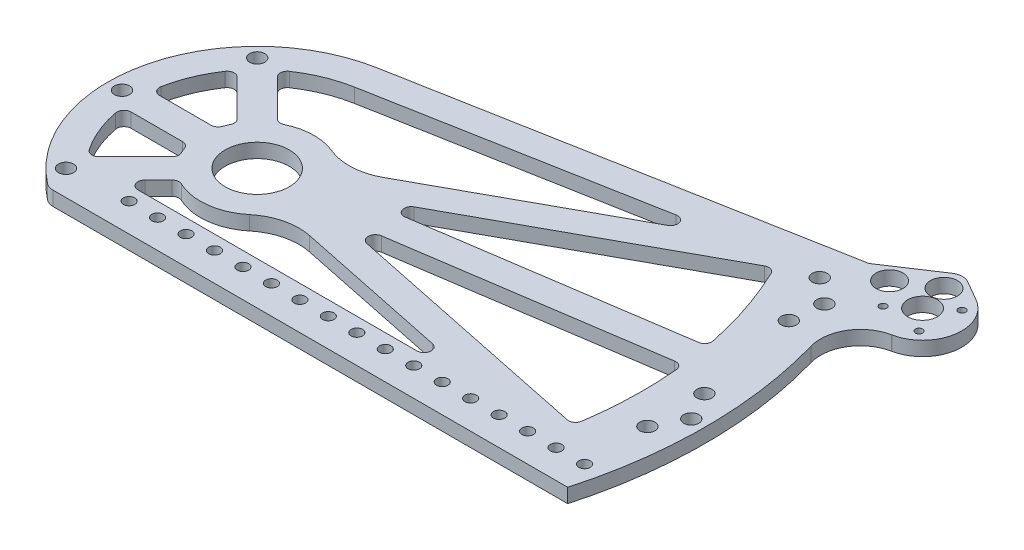
from build123d import *

# Parameters (mm, degrees)
SKETCH1_R           = 3.3782
SKETCH1_R_2         = 14.28115
SKETCH1_R_3         = 2.5527
SKETCH1_R_4         = 9.5885
SKETCH1_R_5         = 19.177
SKETCH1_R_6         = 4.1275
BOSS_EXTRUDE1_DEPTH = 6.35
SKETCH2_R           = 19.177
SKETCH2_R_2         = 2.5527
SKETCH2_R_3         = 4.1275
SKETCH2_R_4         = 9.5885
BOSS_EXTRUDE2_DEPTH = 6.35
CUT_EXTRUDE1_DEPTH  = 337.819467594
BOSS_EXTRUDE3_DEPTH = 6.35
SKETCH9_R           = 6.00075
SKETCH9_R_2         = 1.6
SKETCH9_R_3         = 6.6
BOSS_EXTRUDE4_DEPTH = 6.35
FILLET1_R           = 17.78
SKETCH10_R          = 3.3782
BOSS_EXTRUDE5_DEPTH = 6.35
CUT_EXTRUDE2_DEPTH  = 249.5818865
FILLET2_R           = 25.4
FILLET3_R           = 3.175


with BuildPart() as part:
    # Sketch1 → Boss-Extrude1 (new body)
    with BuildSketch(Plane.XZ):
        with BuildLine():
            Line((231.775, 53.975), (-37.026544532, 53.975))
            ThreePointArc((-37.026544532, 53.975), (-39.086756581, 53.631498674), (-40.924075536, 52.638157895))
            ThreePointArc((-40.924075536, 52.638157895), (-66.304119268, -7.022776738), (-28.989130435, -60.043200628))
            ThreePointArc((-28.989130435, -60.043200628), (-26.371616333, -62.385880153), (-25.4, -65.761600688))
            Line((-25.4, -65.761600688), (-25.4, -230.990796624))
            ThreePointArc((-25.4, -230.990796624), (-23.721010495, -235.292442932), (-19.571917808, -237.3193116))
            ThreePointArc((-19.571917808, -237.3193116), (161.311736549, -175.162893549), (238.125, 0))
            Line((238.125, 0), (238.125, 47.625))
            ThreePointArc((238.125, 47.625), (236.265128061, 52.115128061), (231.775, 53.975))
        make_face()
        with Locations(Location((-60.325, 0, 0), (0, 0, 90))):
            Circle(SKETCH1_R, mode=Mode.SUBTRACT)
        with Locations(Location((-42.656216575, 42.656216575, 0), (0, 0, 90))):
            Circle(SKETCH1_R, mode=Mode.SUBTRACT)
        with Locations(Location((-42.656216575, -42.656216575, 0), (0, 0, 90))):
            Circle(SKETCH1_R, mode=Mode.SUBTRACT)
        with Locations(Location((0, -155.575, 0), (0, 0, 90))):
            Circle(SKETCH1_R, mode=Mode.SUBTRACT)
        with Locations(Location((0, -168.275, 0), (0, 0, 90))):
            Circle(SKETCH1_R, mode=Mode.SUBTRACT)
        with Locations(Location((0, -180.975, 0), (0, 0, 90))):
            Circle(SKETCH1_R, mode=Mode.SUBTRACT)
        with Locations(Location((0, -193.675, 0), (0, 0, 90))):
            Circle(SKETCH1_R, mode=Mode.SUBTRACT)
        with Locations(Location((0, -206.375, 0), (0, 0, 90))):
            Circle(SKETCH1_R, mode=Mode.SUBTRACT)
        with Locations(Location((0, -219.075, 0), (0, 0, 90))):
            Circle(SKETCH1_R, mode=Mode.SUBTRACT)
        with Locations(Location((59.53597499, -143.73255827, 0), (0, 0, 90))):
            Circle(SKETCH1_R, mode=Mode.SUBTRACT)
        with Locations(Location((64.396054581, -155.465828333, 0), (0, 0, 90))):
            Circle(SKETCH1_R, mode=Mode.SUBTRACT)
        with Locations(Location((69.256134172, -167.199098396, 0), (0, 0, 90))):
            Circle(SKETCH1_R, mode=Mode.SUBTRACT)
        with Locations(Location((74.116213763, -178.932368459, 0), (0, 0, 90))):
            Circle(SKETCH1_R, mode=Mode.SUBTRACT)
        with Locations(Location((78.976293354, -190.665638522, 0), (0, 0, 90))):
            Circle(SKETCH1_R, mode=Mode.SUBTRACT)
        with Locations(Location((83.836372945, -202.398908585, 0), (0, 0, 90))):
            Circle(SKETCH1_R, mode=Mode.SUBTRACT)
        with Locations(Location((110.008137483, -110.008137483, 0), (0, 0, 90))):
            Circle(SKETCH1_R, mode=Mode.SUBTRACT)
        with Locations(Location((118.988393604, -118.988393604, 0), (0, 0, 90))):
            Circle(SKETCH1_R, mode=Mode.SUBTRACT)
        with Locations(Location((127.968649725, -127.968649725, 0), (0, 0, 90))):
            Circle(SKETCH1_R, mode=Mode.SUBTRACT)
        with Locations(Location((136.948905846, -136.948905846, 0), (0, 0, 90))):
            Circle(SKETCH1_R, mode=Mode.SUBTRACT)
        with Locations(Location((145.929161967, -145.929161967, 0), (0, 0, 90))):
            Circle(SKETCH1_R, mode=Mode.SUBTRACT)
        with Locations(Location((154.909418088, -154.909418088, 0), (0, 0, 90))):
            Circle(SKETCH1_R, mode=Mode.SUBTRACT)
        with Locations(Location((143.73255827, -59.53597499, 0), (0, 0, 90))):
            Circle(SKETCH1_R, mode=Mode.SUBTRACT)
        with Locations(Location((155.465828333, -64.396054581, 0), (0, 0, 90))):
            Circle(SKETCH1_R, mode=Mode.SUBTRACT)
        with Locations(Location((167.199098396, -69.256134172, 0), (0, 0, 90))):
            Circle(SKETCH1_R, mode=Mode.SUBTRACT)
        with Locations(Location((178.932368459, -74.116213763, 0), (0, 0, 90))):
            Circle(SKETCH1_R, mode=Mode.SUBTRACT)
        with Locations(Location((190.665638522, -78.976293354, 0), (0, 0, 90))):
            Circle(SKETCH1_R, mode=Mode.SUBTRACT)
        with Locations(Location((202.398908585, -83.836372945, 0), (0, 0, 90))):
            Circle(SKETCH1_R, mode=Mode.SUBTRACT)
        with Locations(Location((155.575, 0, 0), (0, 0, 90))):
            Circle(SKETCH1_R, mode=Mode.SUBTRACT)
        with Locations(Location((168.275, 0, 0), (0, 0, 90))):
            Circle(SKETCH1_R, mode=Mode.SUBTRACT)
        with Locations(Location((180.975, 0, 0), (0, 0, 90))):
            Circle(SKETCH1_R, mode=Mode.SUBTRACT)
        with Locations(Location((193.675, 0, 0), (0, 0, 90))):
            Circle(SKETCH1_R, mode=Mode.SUBTRACT)
        with Locations(Location((206.375, 0, 0), (0, 0, 90))):
            Circle(SKETCH1_R, mode=Mode.SUBTRACT)
        with Locations(Location((219.075, 0, 0), (0, 0, 90))):
            Circle(SKETCH1_R, mode=Mode.SUBTRACT)
        with Locations(Location((0, 0, 0), (0, 0, 90))):
            Circle(SKETCH1_R_2, mode=Mode.SUBTRACT)
        with Locations(Location((148.683592319, 12.7, 0), (0, 0, 90))):
            Circle(SKETCH1_R, mode=Mode.SUBTRACT)
        with Locations(Location((141.086323741, -159.046835983, 0), (0, 0, 90))):
            Circle(SKETCH1_R, mode=Mode.SUBTRACT)
        with Locations(Location((150.036456986, -132.075944743, 0), (0, 0, 90))):
            Circle(SKETCH1_R, mode=Mode.SUBTRACT)
        with Locations(Location((150.066579862, -168.027092104, 0), (0, 0, 90))):
            Circle(SKETCH1_R, mode=Mode.SUBTRACT)
        with Locations(Location((159.016713107, -141.056200864, 0), (0, 0, 90))):
            Circle(SKETCH1_R, mode=Mode.SUBTRACT)
        with Locations(Location((-12.7, -186.8261925, 0), (0, 0, 90))):
            Circle(SKETCH1_R, mode=Mode.SUBTRACT)
        with Locations(Location((12.7, -174.083592319, 0), (0, 0, 90))):
            Circle(SKETCH1_R, mode=Mode.SUBTRACT)
        with Locations(Location((-12.7, -199.5261925, 0), (0, 0, 90))):
            Circle(SKETCH1_R, mode=Mode.SUBTRACT)
        with Locations(Location((12.7, -186.783592319, 0), (0, 0, 90))):
            Circle(SKETCH1_R, mode=Mode.SUBTRACT)
        with Locations(Location((-12.7, -212.2261925, 0), (0, 0, 90))):
            Circle(SKETCH1_R, mode=Mode.SUBTRACT)
        with Locations(Location((12.7, -199.483592319, 0), (0, 0, 90))):
            Circle(SKETCH1_R, mode=Mode.SUBTRACT)
        with Locations(Location((-12.7, -224.9261925, 0), (0, 0, 90))):
            Circle(SKETCH1_R, mode=Mode.SUBTRACT)
        with Locations(Location((12.7, -212.183592319, 0), (0, 0, 90))):
            Circle(SKETCH1_R, mode=Mode.SUBTRACT)
        with Locations(Location((69.482177721, -200.931515104, 0), (0, 0, 90))):
            Circle(SKETCH1_R, mode=Mode.SUBTRACT)
        with Locations(Location((88.072335872, -179.438728425, 0), (0, 0, 90))):
            Circle(SKETCH1_R, mode=Mode.SUBTRACT)
        with Locations(Location((74.342257312, -212.664785167, 0), (0, 0, 90))):
            Circle(SKETCH1_R, mode=Mode.SUBTRACT)
        with Locations(Location((92.932415463, -191.171998488, 0), (0, 0, 90))):
            Circle(SKETCH1_R, mode=Mode.SUBTRACT)
        with Locations(Location((50.041859357, -153.998434853, 0), (0, 0, 90))):
            Circle(SKETCH1_R, mode=Mode.SUBTRACT)
        with Locations(Location((68.632017508, -132.505648173, 0), (0, 0, 90))):
            Circle(SKETCH1_R, mode=Mode.SUBTRACT)
        with Locations(Location((54.901938948, -165.731704916, 0), (0, 0, 90))):
            Circle(SKETCH1_R, mode=Mode.SUBTRACT)
        with Locations(Location((73.492097099, -144.238918236, 0), (0, 0, 90))):
            Circle(SKETCH1_R, mode=Mode.SUBTRACT)
        with Locations(Location((59.762018539, -177.464974979, 0), (0, 0, 90))):
            Circle(SKETCH1_R, mode=Mode.SUBTRACT)
        with Locations(Location((78.35217669, -155.972188299, 0), (0, 0, 90))):
            Circle(SKETCH1_R, mode=Mode.SUBTRACT)
        with Locations(Location((64.62209813, -189.198245042, 0), (0, 0, 90))):
            Circle(SKETCH1_R, mode=Mode.SUBTRACT)
        with Locations(Location((83.212256281, -167.705458362, 0), (0, 0, 90))):
            Circle(SKETCH1_R, mode=Mode.SUBTRACT)
        with Locations(Location((123.125811499, -141.086323741, 0), (0, 0, 90))):
            Circle(SKETCH1_R, mode=Mode.SUBTRACT)
        with Locations(Location((132.075944743, -114.115432501, 0), (0, 0, 90))):
            Circle(SKETCH1_R, mode=Mode.SUBTRACT)
        with Locations(Location((132.10606762, -150.066579862, 0), (0, 0, 90))):
            Circle(SKETCH1_R, mode=Mode.SUBTRACT)
        with Locations(Location((141.056200864, -123.095688622, 0), (0, 0, 90))):
            Circle(SKETCH1_R, mode=Mode.SUBTRACT)
        with Locations(Location((200.89215767, -69.465875337, 0), (0, 0, 90))):
            Circle(SKETCH1_R, mode=Mode.SUBTRACT)
        with Locations(Location((202.944625985, -97.808797438, 0), (0, 0, 90))):
            Circle(SKETCH1_R, mode=Mode.SUBTRACT)
        with Locations(Location((189.158887607, -64.605795746, 0), (0, 0, 90))):
            Circle(SKETCH1_R, mode=Mode.SUBTRACT)
        with Locations(Location((191.211355922, -92.948717847, 0), (0, 0, 90))):
            Circle(SKETCH1_R, mode=Mode.SUBTRACT)
        with Locations(Location((105.165299257, -123.125811499, 0), (0, 0, 90))):
            Circle(SKETCH1_R, mode=Mode.SUBTRACT)
        with Locations(Location((114.115432501, -96.154920259, 0), (0, 0, 90))):
            Circle(SKETCH1_R, mode=Mode.SUBTRACT)
        with Locations(Location((114.145555378, -132.10606762, 0), (0, 0, 90))):
            Circle(SKETCH1_R, mode=Mode.SUBTRACT)
        with Locations(Location((123.095688622, -105.13517638, 0), (0, 0, 90))):
            Circle(SKETCH1_R, mode=Mode.SUBTRACT)
        with Locations(Location((153.959077418, -50.025556973, 0), (0, 0, 90))):
            Circle(SKETCH1_R, mode=Mode.SUBTRACT)
        with Locations(Location((156.011545734, -78.368479073, 0), (0, 0, 90))):
            Circle(SKETCH1_R, mode=Mode.SUBTRACT)
        with Locations(Location((142.225807355, -45.165477382, 0), (0, 0, 90))):
            Circle(SKETCH1_R, mode=Mode.SUBTRACT)
        with Locations(Location((144.278275671, -73.508399482, 0), (0, 0, 90))):
            Circle(SKETCH1_R, mode=Mode.SUBTRACT)
        with Locations(Location((177.425617544, -59.745716155, 0), (0, 0, 90))):
            Circle(SKETCH1_R, mode=Mode.SUBTRACT)
        with Locations(Location((179.478085859, -88.088638255, 0), (0, 0, 90))):
            Circle(SKETCH1_R, mode=Mode.SUBTRACT)
        with Locations(Location((165.692347481, -54.885636564, 0), (0, 0, 90))):
            Circle(SKETCH1_R, mode=Mode.SUBTRACT)
        with Locations(Location((167.744815797, -83.228558664, 0), (0, 0, 90))):
            Circle(SKETCH1_R, mode=Mode.SUBTRACT)
        with Locations(Location((-12.7, -161.4261925, 0), (0, 0, 90))):
            Circle(SKETCH1_R, mode=Mode.SUBTRACT)
        with Locations(Location((12.7, -148.683592319, 0), (0, 0, 90))):
            Circle(SKETCH1_R, mode=Mode.SUBTRACT)
        with Locations(Location((-12.7, -174.1261925, 0), (0, 0, 90))):
            Circle(SKETCH1_R, mode=Mode.SUBTRACT)
        with Locations(Location((12.7, -161.383592319, 0), (0, 0, 90))):
            Circle(SKETCH1_R, mode=Mode.SUBTRACT)
        with Locations(Location((186.8261925, -12.7, 0), (0, 0, 90))):
            Circle(SKETCH1_R, mode=Mode.SUBTRACT)
        with Locations(Location((174.083592319, 12.7, 0), (0, 0, 90))):
            Circle(SKETCH1_R, mode=Mode.SUBTRACT)
        with Locations(Location((199.5261925, -12.7, 0), (0, 0, 90))):
            Circle(SKETCH1_R, mode=Mode.SUBTRACT)
        with Locations(Location((186.783592319, 12.7, 0), (0, 0, 90))):
            Circle(SKETCH1_R, mode=Mode.SUBTRACT)
        with Locations(Location((212.2261925, -12.7, 0), (0, 0, 90))):
            Circle(SKETCH1_R, mode=Mode.SUBTRACT)
        with Locations(Location((199.483592319, 12.7, 0), (0, 0, 90))):
            Circle(SKETCH1_R, mode=Mode.SUBTRACT)
        with Locations(Location((224.9261925, -12.7, 0), (0, 0, 90))):
            Circle(SKETCH1_R, mode=Mode.SUBTRACT)
        with Locations(Location((212.183592319, 12.7, 0), (0, 0, 90))):
            Circle(SKETCH1_R, mode=Mode.SUBTRACT)
        with Locations(Location((161.4261925, -12.7, 0), (0, 0, 90))):
            Circle(SKETCH1_R, mode=Mode.SUBTRACT)
        with Locations(Location((174.1261925, -12.7, 0), (0, 0, 90))):
            Circle(SKETCH1_R, mode=Mode.SUBTRACT)
        with Locations(Location((161.383592319, 12.7, 0), (0, 0, 90))):
            Circle(SKETCH1_R, mode=Mode.SUBTRACT)
        with Locations(Location((225.425, 41.275, 0), (0, 0, 90))):
            Circle(SKETCH1_R_3, mode=Mode.SUBTRACT)
        with Locations(Location((212.725, 41.275, 0), (0, 0, 90))):
            Circle(SKETCH1_R_3, mode=Mode.SUBTRACT)
        with Locations(Location((200.025, 41.275, 0), (0, 0, 90))):
            Circle(SKETCH1_R_3, mode=Mode.SUBTRACT)
        with Locations(Location((187.325, 41.275, 0), (0, 0, 90))):
            Circle(SKETCH1_R_3, mode=Mode.SUBTRACT)
        with Locations(Location((174.625, 41.275, 0), (0, 0, 90))):
            Circle(SKETCH1_R_3, mode=Mode.SUBTRACT)
        with Locations(Location((161.925, 41.275, 0), (0, 0, 90))):
            Circle(SKETCH1_R_3, mode=Mode.SUBTRACT)
        with Locations(Location((149.225, 41.275, 0), (0, 0, 90))):
            Circle(SKETCH1_R_3, mode=Mode.SUBTRACT)
        with Locations(Location((136.525, 41.275, 0), (0, 0, 90))):
            Circle(SKETCH1_R_3, mode=Mode.SUBTRACT)
        with Locations(Location((123.825, 41.275, 0), (0, 0, 90))):
            Circle(SKETCH1_R_3, mode=Mode.SUBTRACT)
        with Locations(Location((111.125, 41.275, 0), (0, 0, 90))):
            Circle(SKETCH1_R_3, mode=Mode.SUBTRACT)
        with Locations(Location((98.425, 41.275, 0), (0, 0, 90))):
            Circle(SKETCH1_R_3, mode=Mode.SUBTRACT)
        with Locations(Location((73.025, 41.275, 0), (0, 0, 90))):
            Circle(SKETCH1_R_3, mode=Mode.SUBTRACT)
        with Locations(Location((85.725, 41.275, 0), (0, 0, 90))):
            Circle(SKETCH1_R_3, mode=Mode.SUBTRACT)
        with Locations(Location((60.325, 41.275, 0), (0, 0, 90))):
            Circle(SKETCH1_R_3, mode=Mode.SUBTRACT)
        with Locations(Location((47.625, 41.275, 0), (0, 0, 90))):
            Circle(SKETCH1_R_3, mode=Mode.SUBTRACT)
        with Locations(Location((34.925, 41.275, 0), (0, 0, 90))):
            Circle(SKETCH1_R_3, mode=Mode.SUBTRACT)
        with Locations(Location((22.225, 41.275, 0), (0, 0, 90))):
            Circle(SKETCH1_R_3, mode=Mode.SUBTRACT)
        with Locations(Location((9.525, 41.275, 0), (0, 0, 90))):
            Circle(SKETCH1_R_3, mode=Mode.SUBTRACT)
        with Locations(Location((-3.175, 41.275, 0), (0, 0, 90))):
            Circle(SKETCH1_R_3, mode=Mode.SUBTRACT)
        with Locations(Location((-15.875, 41.275, 0), (0, 0, 90))):
            Circle(SKETCH1_R_3, mode=Mode.SUBTRACT)
        with Locations(Location((-17.960512242, 17.960512242, 0), (0, 0, 90))):
            Circle(SKETCH1_R_3, mode=Mode.SUBTRACT)
        with Locations(Location((-17.960512242, -17.960512242, 0), (0, 0, 90))):
            Circle(SKETCH1_R_3, mode=Mode.SUBTRACT)
        with Locations(Location((17.960512242, -17.960512242, 0), (0, 0, 90))):
            Circle(SKETCH1_R_3, mode=Mode.SUBTRACT)
        with Locations(Location((17.960512242, 17.960512242, 0), (0, 0, 90))):
            Circle(SKETCH1_R_3, mode=Mode.SUBTRACT)
        with Locations(Location((52.114561305, -6.35, 0), (0, 0, 90))):
            Circle(SKETCH1_R_4, mode=Mode.SUBTRACT)
        with Locations(Location((70.075073547, 11.610512242, 0), (0, 0, 90))):
            Circle(SKETCH1_R_3, mode=Mode.SUBTRACT)
        with Locations(Location((-17.960512242, -34.539487758, 0), (0, 0, 90))):
            Circle(SKETCH1_R_3, mode=Mode.SUBTRACT)
        with Locations(Location((17.960512242, -70.460512242, 0), (0, 0, 90))):
            Circle(SKETCH1_R_3, mode=Mode.SUBTRACT)
        with Locations(Location((70.075073547, -24.310512242, 0), (0, 0, 90))):
            Circle(SKETCH1_R_3, mode=Mode.SUBTRACT)
        with Locations(Location((34.154049063, -24.310512242, 0), (0, 0, 90))):
            Circle(SKETCH1_R_3, mode=Mode.SUBTRACT)
        with Locations(Location((34.154049063, 11.610512242, 0), (0, 0, 90))):
            Circle(SKETCH1_R_3, mode=Mode.SUBTRACT)
        with Locations(Location((0, -52.5, 0), (0, 0, 90))):
            Circle(SKETCH1_R_5, mode=Mode.SUBTRACT)
        with Locations(Location((-17.960512242, -70.460512242, 0), (0, 0, 90))):
            Circle(SKETCH1_R_6, mode=Mode.SUBTRACT)
        with Locations(Location((17.960512242, -34.539487758, 0), (0, 0, 90))):
            Circle(SKETCH1_R_6, mode=Mode.SUBTRACT)
    extrude(amount=-BOSS_EXTRUDE1_DEPTH)

    # Sketch2 → Boss-Extrude2 (add, through all)
    with BuildSketch(Plane(origin=(0, 6.35, 0), x_dir=(1, 0, 0), z_dir=(0, 1, 0))):
        with Locations((0, 52.5)):
            Circle(SKETCH2_R)
        with Locations((17.960512242, 70.460512242)):
            Circle(SKETCH2_R_2)
        with Locations((17.960512242, 34.539487758)):
            Circle(SKETCH2_R_3)
        with Locations((-17.960512242, 34.539487758)):
            Circle(SKETCH2_R_2)
        with Locations((-17.960512242, 70.460512242)):
            Circle(SKETCH2_R_3)
        with Locations((34.154049063, -11.610512242)):
            Circle(SKETCH2_R_2)
        with Locations((52.114561305, 6.35)):
            Circle(SKETCH2_R_4)
        with Locations((34.154049063, 24.310512242)):
            Circle(SKETCH2_R_2)
        with Locations((70.075073547, 24.310512242)):
            Circle(SKETCH2_R_2)
        with Locations((70.075073547, -11.610512242)):
            Circle(SKETCH2_R_2)
        with Locations((17.960512242, -17.960512242)):
            Circle(SKETCH2_R_2)
        with Locations((-17.960512242, -17.960512242)):
            Circle(SKETCH2_R_2)
        with Locations((-17.960512242, 17.960512242)):
            Circle(SKETCH2_R_2)
        with Locations((17.960512242, 17.960512242)):
            Circle(SKETCH2_R_2)
    extrude(amount=-BOSS_EXTRUDE2_DEPTH)

    # Sketch3 → Cut-Extrude1 (cut, through all)
    with BuildSketch(Plane(origin=(0, 6.35, 0), x_dir=(1, 0, 0), z_dir=(0, 1, 0))):
        with BuildLine():
            Line((-28.989130435, 60.043200628), (-28.989130435, 240.201050618))
            Line((-28.989130435, 240.201050618), (143.888334306, 240.201050618))
            Line((143.888334306, 240.201050618), (143.888334306, 195.6215824))
            ThreePointArc((143.888334306, 195.6215824), (221.363286109, 99.849646033), (241.876866839, -21.615678064))
            Line((241.876866839, -21.615678064), (241.876866839, -61.19292902))
            Line((241.876866839, -61.19292902), (235.004429082, -61.19292902))
            Line((235.004429082, -61.19292902), (190.335012364, -61.19292902))
            ThreePointArc((190.335012364, -61.19292902), (198.816818934, 21.068080183), (173.283022861, 99.72454804))
            Line((173.283022861, 99.72454804), (-12.081458079, 65.571289416))
            ThreePointArc((-12.081458079, 65.571289416), (-20.720479039, 63.373633109), (-28.989130435, 60.043200628))
        make_face()
    extrude(amount=-CUT_EXTRUDE1_DEPTH, mode=Mode.SUBTRACT)

    # Sketch4 → Boss-Extrude3 (add)
    with BuildSketch(Plane(origin=(0, 6.35, 0), x_dir=(1, 0, 0), z_dir=(0, 1, 0))):
        with BuildLine():
            ThreePointArc((199.712292742, 9.326929894), (199.5261925, 12.7), (199.283126373, 16.069444182))
            ThreePointArc((199.283126373, 16.069444182), (196.154815035, 12.485409157), (199.712292742, 9.326929894))
        make_face()
        with BuildLine():
            ThreePointArc((188.080248089, 67.807166083), (185.962005828, 63.513924813), (190.263971279, 61.413457212))
            ThreePointArc((190.263971279, 61.413457212), (189.199119873, 64.619536774), (188.080248089, 67.807166083))
        make_face()
        with BuildLine():
            ThreePointArc((180.94083811, 85.043545302), (179.478085859, 88.088638255), (177.964091575, 91.108581392))
            ThreePointArc((177.964091575, 91.108581392), (176.445459584, 86.600211868), (180.94083811, 85.043545302))
        make_face()
        with BuildLine():
            ThreePointArc((199.282901438, -16.072233445), (199.52602055, -12.702701167), (199.712170735, -9.329541997))
            ThreePointArc((199.712170735, -9.329541997), (196.11221776, -12.485363516), (199.282901438, -16.072233445))
        make_face()
    extrude(amount=-BOSS_EXTRUDE3_DEPTH)

    # Sketch9 → Boss-Extrude4 (add)
    with BuildSketch(Plane(origin=(0, 6.35, 0), x_dir=(1, 0, 0), z_dir=(0, 1, 0))):
        with BuildLine():
            Line((173.283022861, 99.72454804), (195.603327806, 114.500302414))
            ThreePointArc((195.603327806, 114.500302414), (198.919543637, 115.552562907), (202.292483355, 114.699440851))
            Line((202.292483355, 114.699440851), (211.27381454, 109.494480567))
            ThreePointArc((211.27381454, 109.494480567), (219.765287832, 91.502488859), (205.940797496, 77.195135812))
            Line((205.940797496, 77.195135812), (186.045955896, 73.204465631))
            ThreePointArc((186.045955896, 73.204465631), (180.153149948, 86.699677377), (173.283022861, 99.72454804))
        make_face()
        with Locations(Location((184.517388009, 97.618855822, 0), (0, 0, 270))):
            Circle(SKETCH9_R, mode=Mode.SUBTRACT)
        with Locations(Location((199.571302743, 106.841754978, 0), (0, 0, 270))):
            Circle(SKETCH9_R, mode=Mode.SUBTRACT)
        with Locations(Location((212.083037321, 102.378153756, 0), (0, 0, 270))):
            Circle(SKETCH9_R_2, mode=Mode.SUBTRACT)
        with Locations(Location((210.523861298, 84.769378384, 0), (0, 0, 270))):
            Circle(SKETCH9_R_2, mode=Mode.SUBTRACT)
        with Locations(Location((192.915085926, 86.328554406, 0), (0, 0, 270))):
            Circle(SKETCH9_R_2, mode=Mode.SUBTRACT)
        with Locations(Location((202.499061623, 94.353354081, 0), (0, 0, 270))):
            Circle(SKETCH9_R_3, mode=Mode.SUBTRACT)
    extrude(amount=-BOSS_EXTRUDE4_DEPTH)

    # Fillet1
    fillet1_edges = [part.edges().sort_by_distance(p)[0] for p in [
        (186.045955896, 3.175, -73.204465631),
    ]]
    fillet(fillet1_edges, radius=FILLET1_R)

    # Sketch10 → Boss-Extrude5 (add, through all)
    with BuildSketch(Plane.XZ):
        with Locations((165.692347481, -54.885636564)):
            Circle(SKETCH10_R)
        with Locations((167.199098396, -69.256134172)):
            Circle(SKETCH10_R)
        with Locations((156.011545734, -78.368479073)):
            Circle(SKETCH10_R)
        with Locations((144.278275671, -73.508399482)):
            Circle(SKETCH10_R)
        with Locations((155.465828333, -64.396054581)):
            Circle(SKETCH10_R)
        with Locations((143.73255827, -59.53597499)):
            Circle(SKETCH10_R)
        with Locations((153.959077418, -50.025556973)):
            Circle(SKETCH10_R)
        with Locations((142.225807355, -45.165477382)):
            Circle(SKETCH10_R)
        with Locations((161.4261925, -12.7)):
            Circle(SKETCH10_R)
        with Locations((174.1261925, -12.7)):
            Circle(SKETCH10_R)
        with Locations((155.575, 0)):
            Circle(SKETCH10_R)
        with Locations((168.275, 0)):
            Circle(SKETCH10_R)
        with Locations((180.975, 0)):
            Circle(SKETCH10_R)
        with Locations((148.683592319, 12.7)):
            Circle(SKETCH10_R)
        with Locations((161.383592319, 12.7)):
            Circle(SKETCH10_R)
        with Locations((174.083592319, 12.7)):
            Circle(SKETCH10_R)
    extrude(amount=-BOSS_EXTRUDE5_DEPTH)

    # Sketch11 → Cut-Extrude2 (cut, through all)
    with BuildSketch(Plane.XZ):
        with BuildLine():
            Line((-33.410914966, -42.391171087), (-12.90006314, -21.880319261))
            ThreePointArc((-12.90006314, -21.880319261), (3.594339399, -25.144397473), (18.513644419, -17.389795006))
            Line((18.513644419, -17.389795006), (130.918482186, -79.005145779))
            Line((130.918482186, -79.005145779), (-9.780227968, -53.081520004))
            ThreePointArc((-9.780227968, -53.081520004), (-22.247237963, -49.176834262), (-33.410914966, -42.391171087))
        make_face()
        with BuildLine():
            Line((-24.593444248, -6.35), (-53.600169076, -6.35))
            ThreePointArc((-53.600169076, -6.35), (-49.866397767, -20.655338262), (-42.391171087, -33.410914966))
            Line((-42.391171087, -33.410914966), (-21.880319261, -12.90006314))
            ThreePointArc((-21.880319261, -12.90006314), (-23.466540126, -9.720159182), (-24.593444248, -6.35))
        make_face()
        with BuildLine():
            ThreePointArc((-21.880319261, 12.90006314), (-23.466540126, 9.720159182), (-24.593444248, 6.35))
            Line((-24.593444248, 6.35), (-53.600169076, 6.35))
            ThreePointArc((-53.600169076, 6.35), (-49.866397767, 20.655338262), (-42.391171087, 33.410914966))
            Line((-42.391171087, 33.410914966), (-21.880319261, 12.90006314))
        make_face()
        with BuildLine():
            ThreePointArc((22.791592964, 11.211747864), (7.27428309, 24.336080324), (-12.90006314, 21.880319261))
            Line((-12.90006314, 21.880319261), (-25.944743879, 34.925))
            Line((-25.944743879, 34.925), (137.13572675, 34.925))
            Line((137.13572675, 34.925), (22.791592964, 11.211747864))
        make_face()
        with BuildLine():
            Line((36.155069113, 1.012902532), (170.921182117, -19.144139334))
            ThreePointArc((170.921182117, -19.144139334), (171.92251142, 4.816496038), (169.581266981, 28.683487518))
            Line((169.581266981, 28.683487518), (36.155069113, 1.012902532))
        make_face()
        with BuildLine():
            Line((34.276420825, -11.547379336), (153.767117032, -77.046883692))
            ThreePointArc((153.767117032, -77.046883692), (162.989270808, -54.909436062), (169.042533829, -31.704421203))
            Line((169.042533829, -31.704421203), (34.276420825, -11.547379336))
        make_face()
    extrude(amount=-CUT_EXTRUDE2_DEPTH, mode=Mode.SUBTRACT)

    # Fillet2
    fillet2_edges = [part.edges().sort_by_distance(p)[0] for p in [
        (22.791592964, 3.175, 11.211747864),
        (18.513644419, 3.175, -17.389795006),
    ]]
    fillet(fillet2_edges, radius=FILLET2_R)

    # Fillet3
    fillet3_edges = [part.edges().sort_by_distance(p)[0] for p in [
        (-12.90006314, 3.175, 21.880319261),
        (-25.944743879, 3.175, 34.925),
        (137.13572675, 3.175, 34.925),
        (170.921182117, 3.175, -19.144139334),
        (36.155069113, 3.175, 1.012902532),
        (169.581266981, 3.175, 28.683487518),
        (-21.880319261, 3.175, 12.90006314),
        (-24.593444248, 3.175, 6.35),
        (-53.600169076, 3.175, 6.35),
        (-42.391171087, 3.175, 33.410914966),
        (-53.600169076, 3.175, -6.35),
        (-24.593444248, 3.175, -6.35),
        (-21.880319261, 3.175, -12.90006314),
        (-42.391171087, 3.175, -33.410914966),
        (153.767117032, 3.175, -77.046883692),
        (34.276420825, 3.175, -11.547379336),
        (169.042533829, 3.175, -31.704421203),
        (-33.410914966, 3.175, -42.391171087),
        (-12.90006314, 3.175, -21.880319261),
        (130.918482186, 3.175, -79.005145779),
    ]]
    fillet(fillet3_edges, radius=FILLET3_R)


solid = part.part
